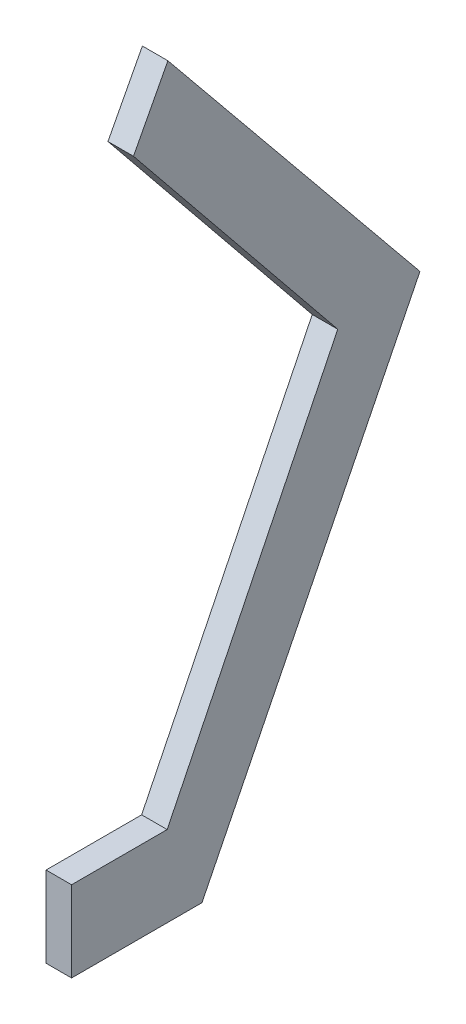
from build123d import *

# Parameters (mm, degrees)
BOSS_EXTRUDE1_DEPTH = 1.25


with BuildPart() as part:
    # Sketch1 → Boss-Extrude1 (new, symmetric)
    with BuildSketch(Plane(origin=(0, 0, 0), x_dir=(0, 0, -1), z_dir=(1, 0, 0))):
        Polygon((0, 0), (-12.774161143, 0), (-12.774161143, 7.911803975), (-3.409816132, 7.911803975), (13.304002672, 42.00520811), (-6.709360554, 66.689059562), (-3.33666023, 73.106446076), (21.356396123, 42.884323233), align=None)
    extrude(amount=BOSS_EXTRUDE1_DEPTH, both=True)


solid = part.part
